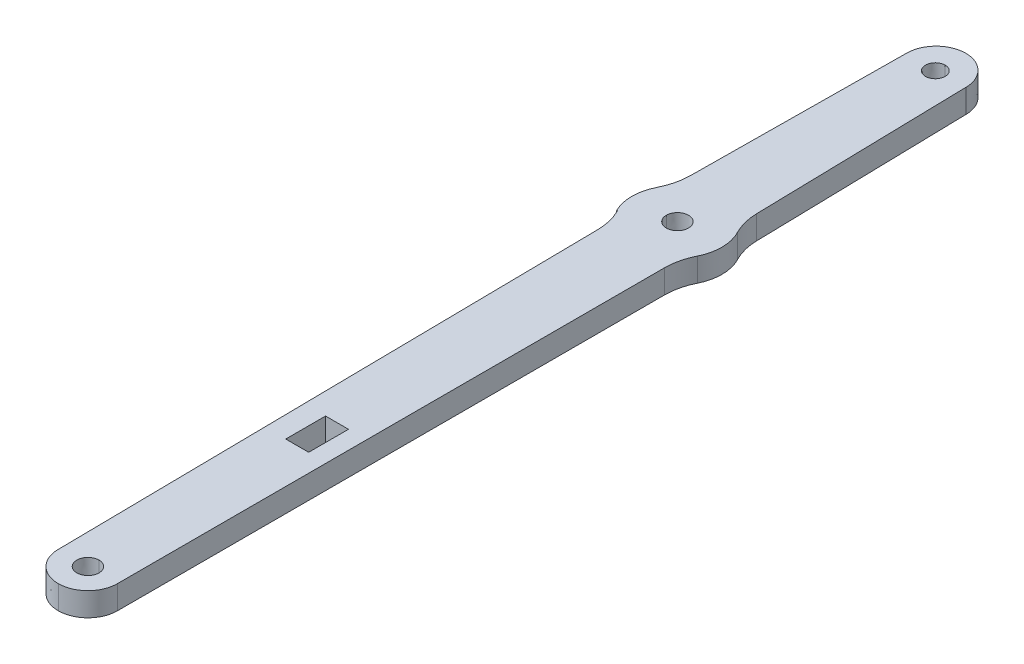
from build123d import *

# Parameters (mm, degrees)
SKETCH1_W           = 3.094120519
SKETCH1_H           = 5.373555217
BOSS_EXTRUDE1_DEPTH = 3.175


with BuildPart() as part:
    # Sketch1 → Boss-Extrude1 (new body)
    with BuildSketch(Plane(origin=(0, 0, 0), x_dir=(1, 0, 0), z_dir=(0, 1, 0))):
        with BuildLine():
            Line((11.671977186, 52.523334551), (11.671977186, 52.423425298))
            Line((11.671977186, 52.423425298), (12.323966158, 23.611960101))
            add(Edge.make_bspline(
                [(12.323966158, 23.611960101), (12.351691288, 22.388184061), (12.659182858, 21.187143968), (13.223317097, 20.101307155)],
                knots=[2, 2, 2, 2, 3, 3, 3, 3], degree=3))
            add(Edge.make_bspline(
                [(13.223317097, 20.101307155), (14.108181558, 18.396931472), (14.125046703, 16.371068711), (13.268433798, 14.65221937)],
                knots=[3, 3, 3, 3, 4, 4, 4, 4], degree=3))
            add(Edge.make_bspline(
                [(13.268433798, 14.65221937), (12.71552999, 13.542396523), (12.42759419, 12.319206461), (12.42759419, 11.078993738)],
                knots=[4, 4, 4, 4, 5, 5, 5, 5], degree=3))
            Line((12.42759419, 11.078993738), (12.427594187, -62.669212002))
            add(Edge.make_bspline(
                [(12.427594187, -62.669212002), (12.427594187, -64.867957813), (10.656013023, -66.654643877), (8.461067967, -66.669176131)],
                knots=[6, 6, 6, 6, 7, 7, 7, 7], degree=3))
            add(Edge.make_bspline(
                [(8.461067967, -66.669176131), (6.265908441, -66.68351306), (4.47102803, -64.920568873), (4.442211054, -62.721823062)],
                knots=[7, 7, 7, 7, 8, 8, 8, 8], degree=3))
            Line((4.442211054, -62.721823062), (3.4742297, 11.019975985))
            add(Edge.make_bspline(
                [(3.4742297, 11.019975985), (3.457929976, 12.260061747), (3.153889424, 13.47965781), (2.586499139, 14.581823877)],
                knots=[9, 9, 9, 9, 10, 10, 10, 10], degree=3))
            Line((2.586499139, 14.581823877), (2.523308462, 14.524339433))
            add(Edge.make_bspline(
                [(2.523308462, 14.524339433), (1.661060843, 16.240434677), (1.671355406, 18.266297438), (2.550975099, 19.97336862)],
                knots=[11, 11, 11, 11, 12, 12, 12, 12], degree=3))
            Line((2.550975099, 19.97336862), (2.560431279, 20.030911662))
            add(Edge.make_bspline(
                [(2.560431279, 20.030911662), (3.109864571, 21.124170864), (3.401660832, 22.329234672), (3.413398194, 23.553186505)],
                knots=[13, 13, 13, 13, 14, 14, 14, 14], degree=3))
            Line((3.413398194, 23.553186505), (3.687237463, 52.370745874))
            Line((3.687237463, 52.370745874), (3.687237463, 52.470713725))
            add(Edge.make_bspline(
                [(3.687237463, 52.470713725), (3.707865583, 54.654810085), (5.473441585, 56.418310951), (7.653705191, 56.432784608)],
                knots=[16, 16, 16, 16, 17, 17, 17, 17], degree=3))
            add(Edge.make_bspline(
                [(7.653705191, 56.432784608), (9.833832316, 56.447121537), (11.622395609, 54.706844933), (11.671977186, 52.523334551)],
                knots=[17, 17, 17, 17, 18, 18, 18, 18], degree=3))
        make_face()
        with Locations((8.434736895, -31.770952097)):
            Rectangle(SKETCH1_W, SKETCH1_H, mode=Mode.SUBTRACT)
        with BuildLine():
            add(Edge.make_bspline(
                [(6.412469483, 17.332150803), (6.41227451, 18.160704197), (7.082727406, 18.832156884), (7.909645957, 18.832156884), (8.736681491, 18.832156884), (9.406939414, 18.160704197), (9.406939414, 17.332150803), (9.406939414, 16.503753669), (8.736681491, 15.832086124), (7.90976294, 15.832086124)],
                knots=[1, 1, 1, 1, 2, 2, 2, 3, 3, 3, 4, 4, 4, 4], degree=3))
            add(Edge.make_bspline(
                [(7.90976294, 15.832086124), (7.082727406, 15.832086124), (6.412469483, 16.503753669), (6.412469483, 17.332150803)],
                knots=[0, 0, 0, 0, 1, 1, 1, 1], degree=3))
        make_face(mode=Mode.SUBTRACT)
        with BuildLine():
            add(Edge.make_bspline(
                [(7.679948527, 53.657670812), (8.410336055, 53.657670812), (9.002780342, 53.064348529), (9.002780342, 52.332657302), (9.002780342, 51.600966075), (8.410336055, 51.00770239), (7.679948527, 51.00770239)],
                knots=[2, 2, 2, 2, 3, 3, 3, 4, 4, 4, 4], degree=3))
            add(Edge.make_bspline(
                [(7.679948527, 51.00770239), (6.949385523, 51.00770239), (6.357389674, 51.600966075), (6.357389674, 52.332657302), (6.357389674, 53.064348529), (6.949385524, 53.657670812), (7.679948527, 53.657670812)],
                knots=[0, 0, 0, 0, 1, 1, 1, 2, 2, 2, 2], degree=3))
        make_face(mode=Mode.SUBTRACT)
        with BuildLine():
            add(Edge.make_bspline(
                [(8.434610161, -61.169147323), (9.261704188, -61.168951998), (9.932157083, -61.840609776), (9.932157083, -62.669026443), (9.932157083, -63.497628669), (9.261704187, -64.169091121), (8.434805134, -64.169091121)],
                knots=[2, 2, 2, 2, 3, 3, 3, 4, 4, 4, 4], degree=3))
            add(Edge.make_bspline(
                [(8.434805134, -64.169091121), (7.60769161, -64.169218083), (6.937258211, -63.497628669), (6.937258211, -62.669212002), (6.937258212, -61.840609776), (7.60769161, -61.169147323), (8.434610161, -61.169147323)],
                knots=[0, 0, 0, 0, 1, 1, 1, 2, 2, 2, 2], degree=3))
        make_face(mode=Mode.SUBTRACT)
    extrude(amount=BOSS_EXTRUDE1_DEPTH)


solid = part.part
